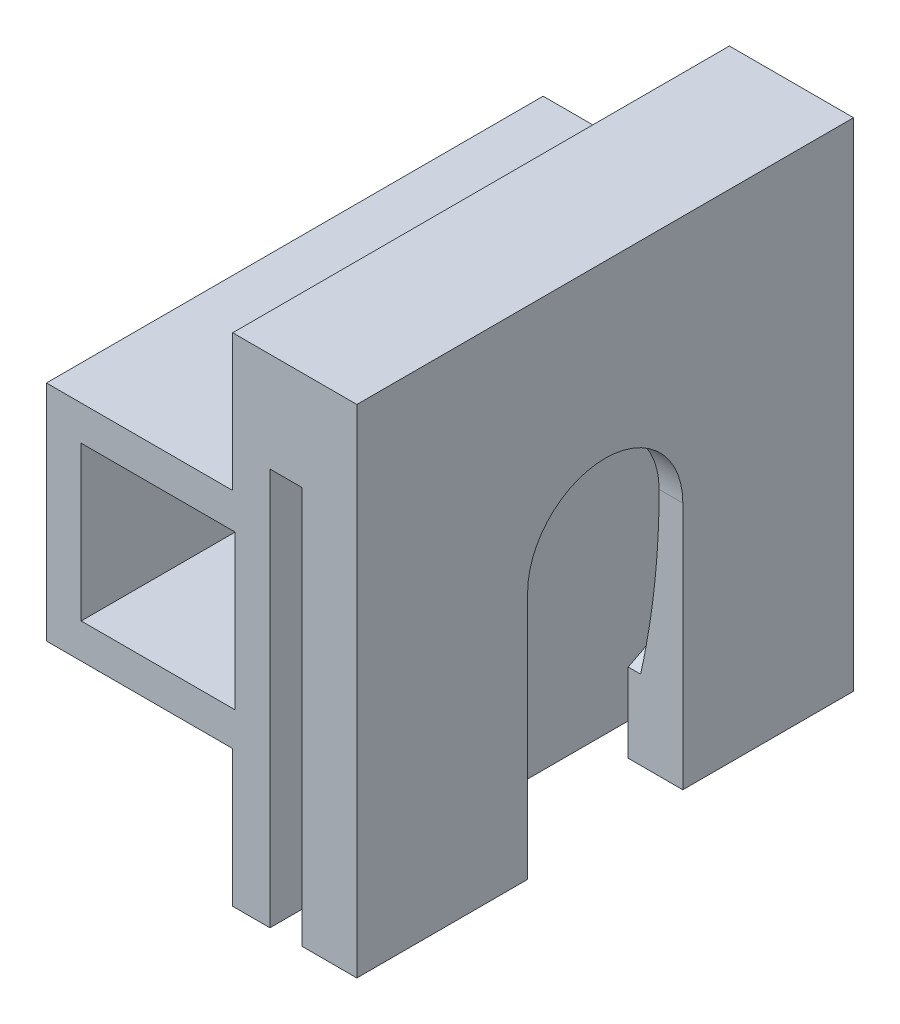
from build123d import *
from build123d.topology import SkipClean

# Parameters (mm, degrees)
SKETCH1_W           = 9
SKETCH1_H           = 9
BOSS_EXTRUDE1_DEPTH = 20
SKETCH2_W           = 6
SKETCH2_H           = 6
CUT_EXTRUDE1_DEPTH  = 21.988091862
SKETCH4_W           = 20
SKETCH4_H           = 20
BOSS_EXTRUDE2_DEPTH = 1.5
SKETCH5_W           = 20
SKETCH5_H           = 20
BOSS_EXTRUDE3_DEPTH = 3.5
SKETCH7_W           = 1.8
SKETCH7_H           = 20
CUT_EXTRUDE5_DEPTH  = 16
CUT_EXTRUDE6_START  = -1.7
CUT_EXTRUDE6_DEPTH  = 1.7
BOSS_EXTRUDE4_START = 0.5
BOSS_EXTRUDE4_DEPTH = 0.5
SKETCH10_W          = 6.2
SKETCH10_H          = 6.2
CUT_EXTRUDE8_DEPTH  = 24.748684208


with BuildPart() as part:
    # Sketch1 → Boss-Extrude1 (new body)
    with BuildSketch(Plane.XY):
        Rectangle(SKETCH1_W, SKETCH1_H)
    extrude(amount=BOSS_EXTRUDE1_DEPTH)

    # Sketch2 → Cut-Extrude1 (cut, through all)
    with BuildSketch(Plane(origin=(0, 0, 0), x_dir=(-1, 0, 0), z_dir=(0, 0, -1))):
        Rectangle(SKETCH2_W, SKETCH2_H)
    extrude(amount=-CUT_EXTRUDE1_DEPTH, mode=Mode.SUBTRACT)

    # Sketch4 → Boss-Extrude2 (add)
    with BuildSketch(Plane(origin=(4.5, 0, 0), x_dir=(0, 0, -1), z_dir=(1, 0, 0))):
        with Locations((-10, 0)):
            Rectangle(SKETCH4_W, SKETCH4_H)
    extrude(amount=-BOSS_EXTRUDE2_DEPTH)

    # Sketch5 → Boss-Extrude3 (add)
    with BuildSketch(Plane(origin=(4.5, 0, 0), x_dir=(0, 0, -1), z_dir=(1, 0, 0))):
        with Locations((-10, 0)):
            Rectangle(SKETCH5_W, SKETCH5_H)
    extrude(amount=BOSS_EXTRUDE3_DEPTH)

    # Sketch6 → Cut-Revolve2 (revolve, cut)
    with BuildSketch(Plane(origin=(0, 0, 10), x_dir=(-1, 0, 0), z_dir=(0, 0, -1)), mode=Mode.PRIVATE) as cut_revolve2_sk:
        with BuildLine():
            Line((-4.5, 7.5), (-4.5, 0))
            Line((-4.5, 0), (-7.200284, 0))
            ThreePointArc((-7.200284, 0), (-6.974408022, 3.776920415), (-6.3, 7.5))
            Line((-6.3, 7.5), (-4.5, 7.5))
        make_face()
    revolve(cut_revolve2_sk.sketch.rotate(Axis((88.99, 0, 10), (-1, 0, 0)), 90), axis=Axis((88.99, 0, 10), (-1, 0, 0)), mode=Mode.SUBTRACT)

    # Sketch7 → Cut-Extrude5 (cut)
    with BuildSketch(Plane.XZ.offset(10)):
        with Locations((5.4, 10)):
            Rectangle(SKETCH7_W, SKETCH7_H)
    extrude(amount=-CUT_EXTRUDE5_DEPTH, mode=Mode.SUBTRACT)

    # Sketch8 → Cut-Extrude6 (cut)
    with BuildSketch(Plane(origin=(8, 0, 0), x_dir=(0, 0, -1), z_dir=(1, 0, 0)).offset(CUT_EXTRUDE6_START)):
        with BuildLine():
            Line((-6.875, 0), (-6.875, -10))
            ThreePointArc((-6.875, -10), (-10, -13.125), (-13.125, -10))
            Line((-13.125, -10), (-13.125, 0))
            ThreePointArc((-13.125, 0), (-10, 3.125), (-6.875, 0))
        make_face()
    extrude(amount=CUT_EXTRUDE6_DEPTH, mode=Mode.SUBTRACT)

    # Sketch9 → Boss-Extrude4 (add)
    with SkipClean():  # the faces are left unmerged after this step: merging them gives an invalid solid
        with BuildSketch(Plane.ZY.offset(-6.3).offset(BOSS_EXTRUDE4_START)):
            with BuildLine():
                Line((13.125, -6.817945072), (13.125, -10))
                Line((13.125, -10), (20, -10))
                Line((20, -10), (20, 6))
                Line((20, 6), (14.5, 6))
                ThreePointArc((14.5, 6), (17.457216989, -0.799946739), (13.125, -6.817945072))
            make_face()
            with BuildLine():
                Line((0, -10), (6.875, -10))
                Line((6.875, -10), (6.875, -6.817945072))
                ThreePointArc((6.875, -6.817945072), (2.542783011, -0.799946739), (5.5, 6))
                Line((5.5, 6), (0, 6))
                Line((0, 6), (0, -10))
            make_face()
        extrude(amount=-BOSS_EXTRUDE4_DEPTH)

    # Sketch10 → Cut-Extrude8 (cut, through all)
    with SkipClean():  # the faces are left unmerged after this step: merging them gives an invalid solid
        with BuildSketch(Plane(origin=(0, 0, 0), x_dir=(-1, 0, 0), z_dir=(0, 0, -1))):
            Rectangle(SKETCH10_W, SKETCH10_H)
        extrude(amount=-CUT_EXTRUDE8_DEPTH, mode=Mode.SUBTRACT)


solid = part.part
